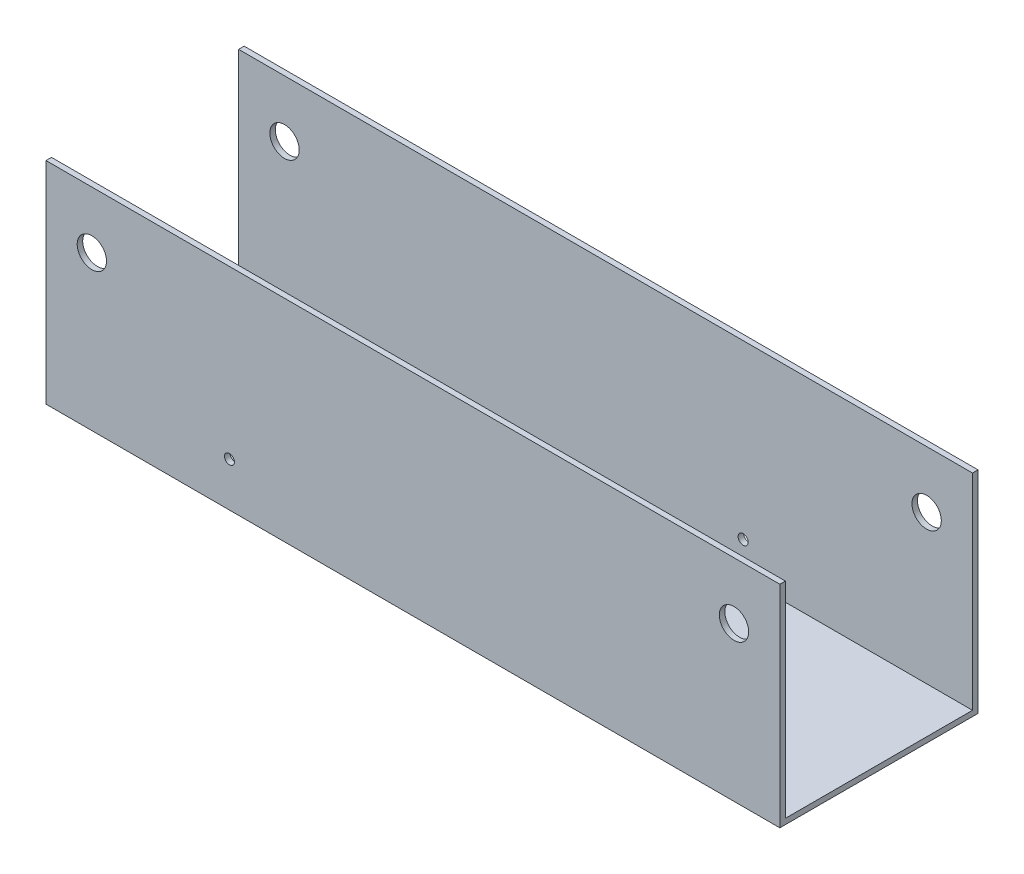
from build123d import *

# Parameters (mm, degrees)
SKETCH1_W           = 400
SKETCH1_H           = 108
BOSS_EXTRUDE1_DEPTH = 65
SKETCH3_W           = 400
SKETCH3_H           = 102
CUT_EXTRUDE1_DEPTH  = 158
SKETCH4_R           = 8
CUT_EXTRUDE2_DEPTH  = 158
SKETCH6_W           = 400
SKETCH6_H           = 3
BOSS_EXTRUDE3_DEPTH = 50
SKETCH7_W           = 400
SKETCH7_H           = 3
BOSS_EXTRUDE4_DEPTH = 102
SKETCH11_R          = 2.7
CUT_EXTRUDE4_DEPTH  = 75
SKETCH10_R          = 2.75
CUT_EXTRUDE3_DEPTH  = 75


with BuildPart() as part:
    # Sketch1 → Boss-Extrude1 (new body)
    with BuildSketch(Plane(origin=(0, 0, 0), x_dir=(1, 0, 0), z_dir=(0, 1, 0))):
        with Locations((66.180492252, 90.484958979)):
            Rectangle(SKETCH1_W, SKETCH1_H)
    extrude(amount=BOSS_EXTRUDE1_DEPTH)

    # Sketch3 → Cut-Extrude1 (cut)
    with BuildSketch(Plane.XZ):
        with Locations((66.180492252, -90.484958979)):
            Rectangle(SKETCH3_W, SKETCH3_H)
    extrude(amount=-CUT_EXTRUDE1_DEPTH, mode=Mode.SUBTRACT)


with BuildPart() as cut_extrude1_piece_1:
    # of the separate pieces the step leaves, piece 1, a body of its own (cut_extrude1_pieces)
    add(part.part.solids().sort_by_distance((-133.819507748, 0, -144.484958979))[0])


with BuildPart() as cut_extrude1_piece_2:
    # of the separate pieces the step leaves, piece 2, a body of its own (cut_extrude1_pieces)
    add(part.part.solids().sort_by_distance((-133.819507748, 0, -36.484958979))[0])


with BuildPart() as cut_extrude2_tool:
    # Sketch4 → Cut-Extrude2 (new body)
    with BuildSketch(Plane.XY.offset(-36.484958979)):
        with Locations((-108.819507748, 34)):
            Circle(SKETCH4_R)
        with Locations((241.180492252, 34)):
            Circle(SKETCH4_R)
    extrude(amount=-CUT_EXTRUDE2_DEPTH)


with BuildPart() as cut_extrude1_piece_1_1:
    add(cut_extrude1_piece_1.part)

    # Cut-Extrude2: cut by cut_extrude2_tool
    add(cut_extrude2_tool.part, mode=Mode.SUBTRACT)



with BuildPart() as cut_extrude1_piece_2_1:
    add(cut_extrude1_piece_2.part)

    # Cut-Extrude2: cut by cut_extrude2_tool
    add(cut_extrude2_tool.part, mode=Mode.SUBTRACT)


with BuildPart() as cut_extrude1_piece_1_2:
    add(cut_extrude1_piece_1_1.part)

    add(cut_extrude1_piece_2_1.part)  # Boss-Extrude3 merges Cut-Extrude1 piece 2
    # Sketch6 → Boss-Extrude3 (add)
    with BuildSketch(Plane.XZ):
        with Locations((66.180492252, -37.984958979)):
            Rectangle(SKETCH6_W, SKETCH6_H)
        with Locations((66.180492252, -142.984958979)):
            Rectangle(SKETCH6_W, SKETCH6_H)
    extrude(amount=BOSS_EXTRUDE3_DEPTH)

    # Sketch7 → Boss-Extrude4 (add)
    with BuildSketch(Plane(origin=(0, 0, -39.484958979), x_dir=(-1, 0, 0), z_dir=(0, 0, -1))):
        with Locations((-66.180492252, -48.5)):
            Rectangle(SKETCH7_W, SKETCH7_H)
    extrude(amount=BOSS_EXTRUDE4_DEPTH)

    # Sketch11 → Cut-Extrude4 (cut)
    with BuildSketch(Plane.XY.offset(-36.484958979)):
        with Locations((-33.819507748, -25.95)):
            Circle(SKETCH11_R)
    extrude(amount=-CUT_EXTRUDE4_DEPTH, mode=Mode.SUBTRACT)

    # Sketch10 → Cut-Extrude3 (cut)
    with BuildSketch(Plane(origin=(0, 0, -144.484958979), x_dir=(-1, 0, 0), z_dir=(0, 0, -1))):
        with Locations((-141.180492252, -28.85)):
            Circle(SKETCH10_R)
    extrude(amount=-CUT_EXTRUDE3_DEPTH, mode=Mode.SUBTRACT)


solid = cut_extrude1_piece_1_2.part
